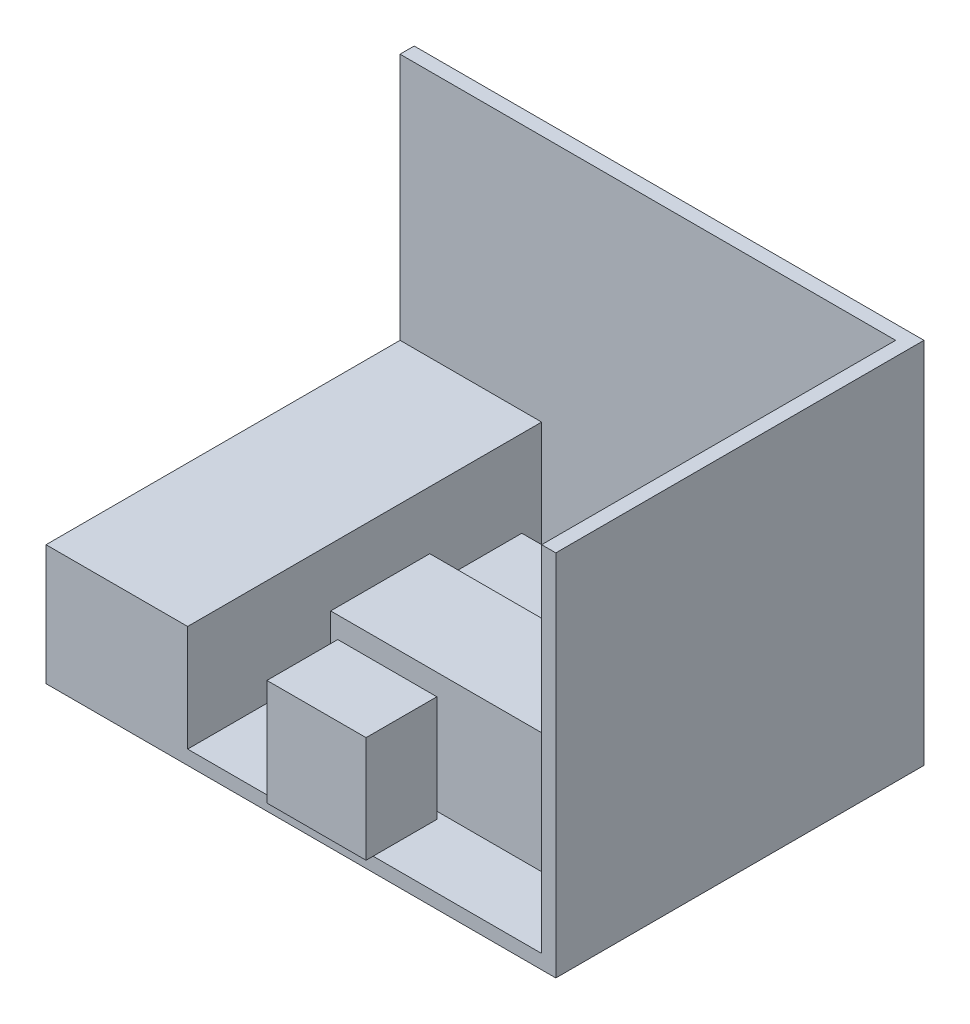
from build123d import *

# Parameters (mm, degrees)
SKETCH1_W           = 3600
SKETCH1_H           = 2600
BOSS_EXTRUDE1_DEPTH = 100
BOSS_EXTRUDE2_DEPTH = 2500
SKETCH4_W           = 2000
SKETCH4_H           = 700
BOSS_EXTRUDE3_DEPTH = 850
SKETCH5_W           = 1000
SKETCH5_H           = 2500
BOSS_EXTRUDE4_DEPTH = 750
SKETCH6_W           = 700
SKETCH6_H           = 500
BOSS_EXTRUDE5_DEPTH = 750
SKETCH7_W           = 700
SKETCH7_H           = 500
BOSS_EXTRUDE6_DEPTH = 750


with BuildPart() as part:
    # Sketch1 → Boss-Extrude1 (new body)
    with BuildSketch(Plane(origin=(0, 0, 0), x_dir=(1, 0, 0), z_dir=(0, 1, 0))):
        with Locations((1800, 1300)):
            Rectangle(SKETCH1_W, SKETCH1_H)
    extrude(amount=BOSS_EXTRUDE1_DEPTH)

    # Sketch2 → Boss-Extrude2 (add)
    with BuildSketch(Plane(origin=(0, 100, 0), x_dir=(1, 0, 0), z_dir=(0, 1, 0))):
        Polygon((3600, 0), (3500, 0), (3500, 2500), (0, 2500), (0, 2600), (3600, 2600), align=None)
    extrude(amount=BOSS_EXTRUDE2_DEPTH)

    # Sketch4 → Boss-Extrude3 (add)
    with BuildSketch(Plane(origin=(0, 100, 0), x_dir=(1, 0, 0), z_dir=(0, 1, 0))):
        with Locations((2510, 850)):
            Rectangle(SKETCH4_W, SKETCH4_H)
    extrude(amount=BOSS_EXTRUDE3_DEPTH)

    # Sketch5 → Boss-Extrude4 (add)
    with BuildSketch(Plane(origin=(0, 100, 0), x_dir=(1, 0, 0), z_dir=(0, 1, 0))):
        with Locations((500, 1250)):
            Rectangle(SKETCH5_W, SKETCH5_H)
    extrude(amount=BOSS_EXTRUDE4_DEPTH)

    # Sketch6 → Boss-Extrude5 (add)
    with BuildSketch(Plane(origin=(0, 100, 0), x_dir=(1, 0, 0), z_dir=(0, 1, 0))):
        with Locations((1960, 1500)):
            Rectangle(SKETCH6_W, SKETCH6_H)
    extrude(amount=BOSS_EXTRUDE5_DEPTH)

    # Sketch7 → Boss-Extrude6 (add)
    with BuildSketch(Plane(origin=(0, 100, 0), x_dir=(1, 0, 0), z_dir=(0, 1, 0))):
        with Locations((1960, 200)):
            Rectangle(SKETCH7_W, SKETCH7_H)
    extrude(amount=BOSS_EXTRUDE6_DEPTH)


solid = part.part
